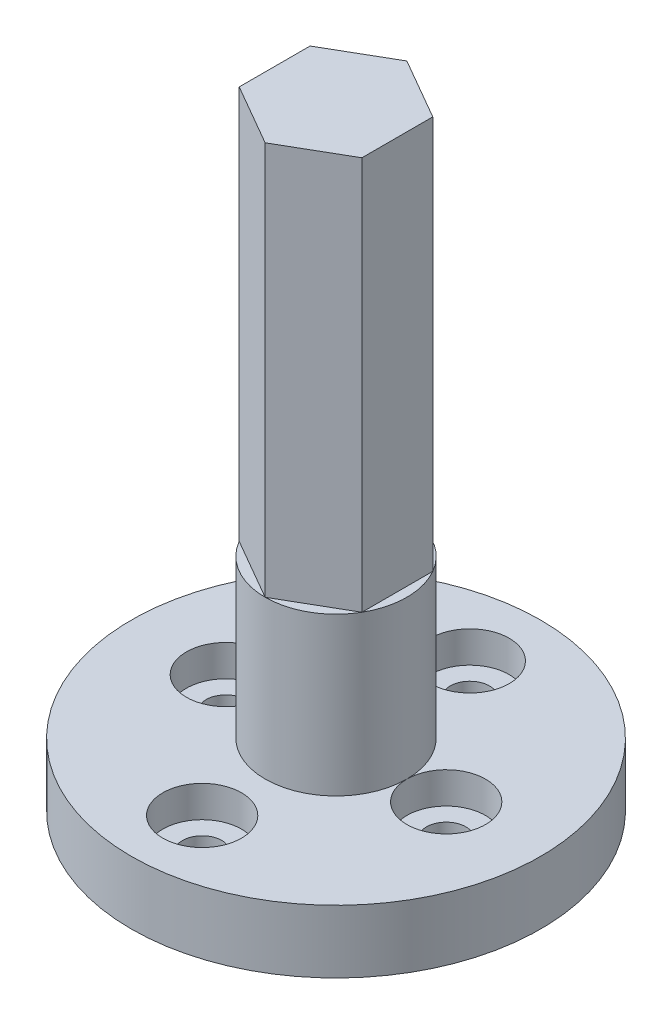
from build123d import *

# Parameters (mm, degrees)
CROQUIS3_R                 = 13
SALIENTE_EXTRUIR1_DEPTH    = 4
CROQUIS4_R                 = 4.5
SALIENTE_EXTRUIR2_DEPTH    = 35
CORTAR_EXTRUIR3_DEPTH      = 44.116122275
CORTAR_EXTRUIR3_DEPTH_BACK = 44.116122275
CROQUIS8_R                 = 1.25
CORTAR_EXTRUIR5_DEPTH      = 40.534794802
CORTAR_EXTRUIR5_DEPTH_BACK = 2
CROQUIS10_R                = 2.5
CROQUIS10_R_2              = 1.25
CROQUIS9_R                 = 1.625
CORTAR_EXTRUIR4_DEPTH      = 3
CROQUIS11_R                = 4
CORTAR_EXTRUIR6_DEPTH      = 0.5
CROQUIS12_OUTSIDE_W        = 38.72
CROQUIS12_OUTSIDE_H        = 38.72
CORTAR_EXTRUIR7_DEPTH      = 25


with BuildPart() as part:
    # Croquis3 → Saliente-Extruir1 (new body)
    with BuildSketch(Plane(origin=(0, 0, 0), x_dir=(1, 0, 0), z_dir=(0, 1, 0))):
        with Locations(Location((0, 0, 0), (0, 0, 270))):
            Circle(CROQUIS3_R)
    extrude(amount=SALIENTE_EXTRUIR1_DEPTH)

    # Croquis4 → Saliente-Extruir2 (add)
    with BuildSketch(Plane(origin=(0, 4, 0), x_dir=(1, 0, 0), z_dir=(0, 1, 0))):
        with Locations(Location((0, 0, 0), (0, 0, 270))):
            Circle(CROQUIS4_R)
    extrude(amount=SALIENTE_EXTRUIR2_DEPTH)

    # Croquis8 → Cortar-Extruir3 (cut, two sides: drawn at the far end of the back side and taken through both)
    with BuildSketch(Plane.XZ.offset(-CORTAR_EXTRUIR3_DEPTH_BACK)):
        with Locations(Location((0, 8.5, 0), (0, 0, 90))):
            Circle(CROQUIS8_R)
        with Locations(Location((0, -8.5, 0), (0, 0, 90))):
            Circle(CROQUIS8_R)
        with Locations(Location((-7, 0, 0), (0, 0, 90))):
            Circle(CROQUIS8_R)
        with Locations(Location((7, 0, 0), (0, 0, 90))):
            Circle(CROQUIS8_R)
    extrude(amount=CORTAR_EXTRUIR3_DEPTH + CORTAR_EXTRUIR3_DEPTH_BACK, mode=Mode.SUBTRACT)

    # Croquis10 → Cortar-Extruir5 (cut, two sides: drawn at the far end of the back side and taken through both)
    # profile 1 of 4: a face of its own
    with BuildSketch(Plane(origin=(0, 4, 0), x_dir=(1, 0, 0), z_dir=(0, 1, 0)).offset(-CORTAR_EXTRUIR5_DEPTH_BACK)):
        with Locations(Location((0, 8.5, 0), (0, 0, 270))):
            Circle(CROQUIS10_R)
    # profile 2 of 4: a face of its own
    with BuildSketch(Plane(origin=(0, 4, 0), x_dir=(1, 0, 0), z_dir=(0, 1, 0)).offset(-CORTAR_EXTRUIR5_DEPTH_BACK)):
        with Locations(Location((0, -8.5, 0), (0, 0, 270))):
            Circle(CROQUIS10_R)
    # profile 3 of 4: a face of its own
    with BuildSketch(Plane(origin=(0, 4, 0), x_dir=(1, 0, 0), z_dir=(0, 1, 0)).offset(-CORTAR_EXTRUIR5_DEPTH_BACK)):
        with Locations(Location((-7, 0, 0), (0, 0, 0.000410889))):
            Circle(CROQUIS10_R)
        with Locations(Location((-7, 0, 0), (0, 0, 270))):
            Circle(CROQUIS10_R_2, mode=Mode.SUBTRACT)
    # profile 4 of 4: a face of its own
    with BuildSketch(Plane(origin=(0, 4, 0), x_dir=(1, 0, 0), z_dir=(0, 1, 0)).offset(-CORTAR_EXTRUIR5_DEPTH_BACK)):
        with Locations(Location((7, 0, 0), (0, 0, 180.000410889))):
            Circle(CROQUIS10_R)
        with Locations(Location((7, 0, 0), (0, 0, 270))):
            Circle(CROQUIS10_R_2, mode=Mode.SUBTRACT)
    extrude(amount=CORTAR_EXTRUIR5_DEPTH + CORTAR_EXTRUIR5_DEPTH_BACK, mode=Mode.SUBTRACT)

    # Croquis9 → Cortar-Extruir4 (cut)
    with BuildSketch(Plane(origin=(0, 0, 0), x_dir=(1, 0, 0), z_dir=(0, 1, 0))):
        with Locations(Location((0, 0, 0), (0, 0, 270))):
            Circle(CROQUIS9_R)
    extrude(amount=CORTAR_EXTRUIR4_DEPTH, mode=Mode.SUBTRACT)

    # Croquis11 → Cortar-Extruir6 (cut)
    with BuildSketch(Plane.XZ):
        with Locations(Location((0, 0, 0), (0, 0, 270))):
            Circle(CROQUIS11_R)
    extrude(amount=-CORTAR_EXTRUIR6_DEPTH, mode=Mode.SUBTRACT)

    # Croquis12 outside → Cortar-Extruir7 (cut)
    with BuildSketch(Plane(origin=(0, 39, 0), x_dir=(1, 0, 0), z_dir=(0, 1, 0))):
        Rectangle(CROQUIS12_OUTSIDE_W, CROQUIS12_OUTSIDE_H)
        Polygon((0, 4.5), (-3.897114317, 2.25), (-3.897114317, -2.25), (0, -4.5), (3.897114317, -2.25), (3.897114317, 2.25), align=None, mode=Mode.SUBTRACT)
    extrude(amount=-CORTAR_EXTRUIR7_DEPTH, mode=Mode.SUBTRACT)


solid = part.part
